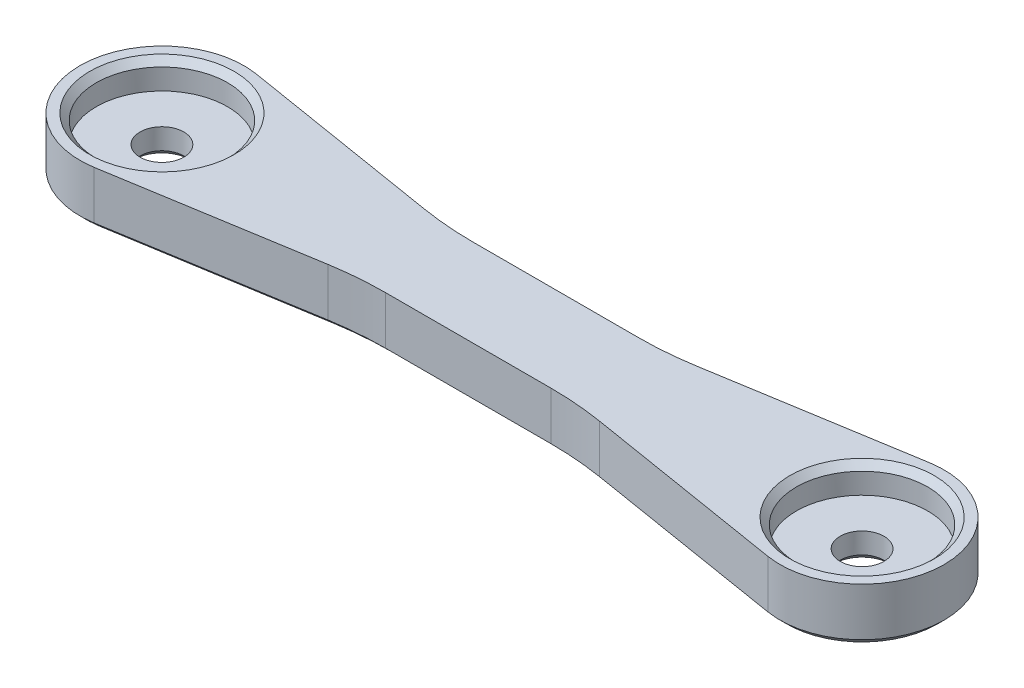
from build123d import *

# Parameters (mm, degrees)
SKETCH1_R           = 2
BOSS_EXTRUDE1_DEPTH = 5
SKETCH1_3_R         = 6
SKETCH1_3_R_2       = 2
CUT_EXTRUDE1_DEPTH  = 2.5
FILLET1_R           = 30
CHAMFER1_SIZE       = 0.6
CHAMFER2_SIZE       = 0.6


with BuildPart() as part:
    # Sketch1 → Boss-Extrude1 (new body)
    with BuildSketch(Plane(origin=(0, 0, 0), x_dir=(1, 0, 0), z_dir=(0, 1, 0))):
        with BuildLine():
            Line((10, 4), (-10, 4))
            Line((-10, 4), (-30.788922466, 7.401573563))
            ThreePointArc((-30.788922466, 7.401573563), (-39.5, 0), (-30.788922466, -7.401573563))
            Line((-30.788922466, -7.401573563), (-10, -4))
            Line((-10, -4), (10, -4))
            Line((10, -4), (30.788922466, -7.401573563))
            ThreePointArc((30.788922466, -7.401573563), (39.5, 0), (30.788922466, 7.401573563))
            Line((30.788922466, 7.401573563), (10, 4))
        make_face()
        with Locations((-32, 0)):
            Circle(SKETCH1_R, mode=Mode.SUBTRACT)
        with Locations((32, 0)):
            Circle(SKETCH1_R, mode=Mode.SUBTRACT)
    extrude(amount=-BOSS_EXTRUDE1_DEPTH)

    # Sketch1<3> → Cut-Extrude1 (cut)
    # profile 1 of 2: a face of its own
    with BuildSketch(Plane(origin=(0, 0, 0), x_dir=(1, 0, 0), z_dir=(0, 1, 0))):
        with Locations((-32, 0)):
            Circle(SKETCH1_3_R)
        with Locations((-32, 0)):
            Circle(SKETCH1_3_R_2, mode=Mode.SUBTRACT)
    # profile 2 of 2: a face of its own
    with BuildSketch(Plane(origin=(0, 0, 0), x_dir=(1, 0, 0), z_dir=(0, 1, 0))):
        with Locations((32, 0)):
            Circle(SKETCH1_3_R)
        with Locations((32, 0)):
            Circle(SKETCH1_3_R_2, mode=Mode.SUBTRACT)
    extrude(amount=-CUT_EXTRUDE1_DEPTH, mode=Mode.SUBTRACT)

    # Fillet1
    fillet1_edges = [part.edges().sort_by_distance(p)[0] for p in [
        (10, -2.5, -4),
        (-10, -2.5, -4),
        (10, -2.5, 4),
        (-10, -2.5, 4),
    ]]
    fillet(fillet1_edges, radius=FILLET1_R)

    # Chamfer1
    chamfer1_edges = [part.edges().sort_by_distance(p)[0] for p in [
        (-39.5, -5, 0),
        (-21.597539474, -5, 5.897639656),
        (0, -5, 4),
        (21.597539474, -5, 5.897639656),
        (39.5, -5, 0),
        (21.597539474, -5, -5.897639656),
        (0, -5, -4),
        (-21.597539474, -5, -5.897639656),
        (-34, -5, 0),
        (30, -5, 0),
        (-9.991987542, -5, 4.098588432),
        (9.991987542, -5, 4.098588432),
        (9.991987542, -5, -4.098588432),
        (-9.991987542, -5, -4.098588432),
    ]]
    chamfer(chamfer1_edges, length=CHAMFER1_SIZE)

    # Chamfer2
    chamfer2_edges = [part.edges().sort_by_distance(p)[0] for p in [
        (26, 0, 0),
        (-38, 0, 0),
    ]]
    chamfer(chamfer2_edges, length=CHAMFER2_SIZE)


solid = part.part
